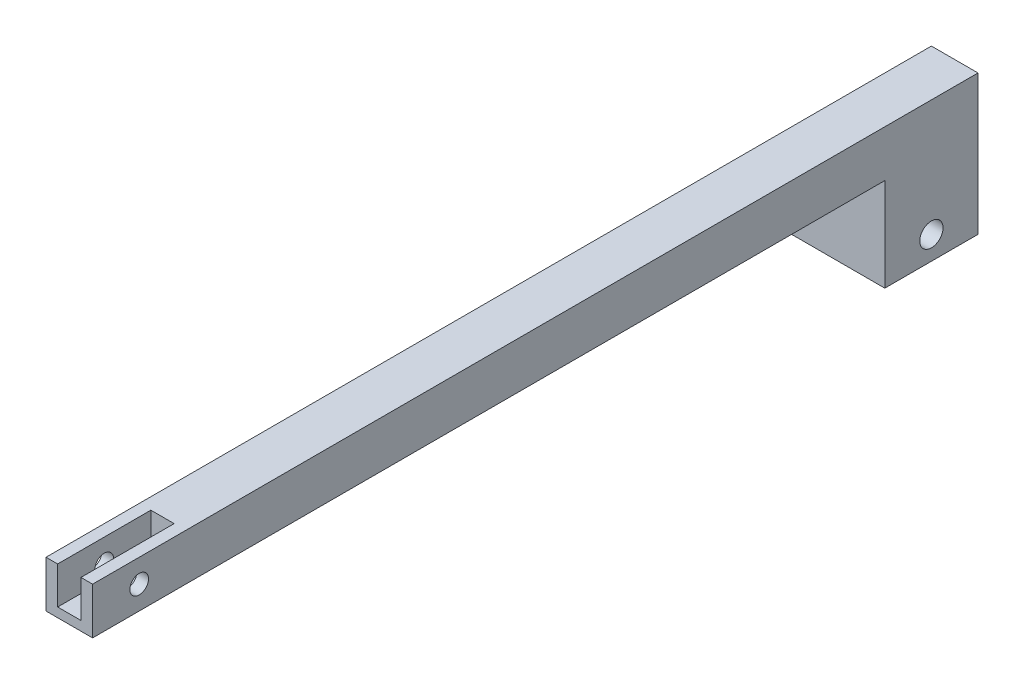
from build123d import *

# Parameters (mm, degrees)
BOSS_EXTRUDE1_DEPTH = 190
SKETCH3_W           = 10
SKETCH3_H           = 170
CUT_EXTRUDE2_DEPTH  = 20
SKETCH4_W           = 170
SKETCH4_H           = 10
CUT_EXTRUDE3_DEPTH  = 20
SKETCH5_R           = 2.75
CUT_EXTRUDE4_DEPTH  = 10
SKETCH6_W           = 5
SKETCH6_H           = 20
CUT_EXTRUDE5_DEPTH  = 5
BOSS_EXTRUDE2_REACH = 195.391
SKETCH9_R           = 2.75
SKETCH9_R_2         = 2.5
SKETCH10_R          = 2.5
CUT_EXTRUDE6_DEPTH  = 194.390796058
SKETCH11_W          = 5
SKETCH11_H          = 20
CUT_EXTRUDE7_DEPTH  = 3
SKETCH12_R          = 2
CUT_EXTRUDE8_DEPTH  = 193.613602843


with BuildPart() as part:
    # Sketch2 → Boss-Extrude1 (new body)
    with BuildSketch(Plane.XY):
        Polygon((0, 0), (0, 10), (10, 10), (10, 30), (20, 30), (20, 0), align=None)
    extrude(amount=BOSS_EXTRUDE1_DEPTH)

    # Sketch3 → Cut-Extrude2 (cut)
    with BuildSketch(Plane.XZ):
        with Locations((15, 105)):
            Rectangle(SKETCH3_W, SKETCH3_H)
    extrude(amount=-CUT_EXTRUDE2_DEPTH, mode=Mode.SUBTRACT)

    # Sketch4 → Cut-Extrude3 (cut)
    with BuildSketch(Plane(origin=(10, 0, 0), x_dir=(0, 0, -1), z_dir=(1, 0, 0))):
        with Locations((-105, 5)):
            Rectangle(SKETCH4_W, SKETCH4_H)
    extrude(amount=-CUT_EXTRUDE3_DEPTH, mode=Mode.SUBTRACT)

    # Sketch5 → Cut-Extrude4 (cut)
    with BuildSketch(Plane.ZY):
        with Locations((10, 5)):
            Circle(SKETCH5_R)
    extrude(amount=-CUT_EXTRUDE4_DEPTH, mode=Mode.SUBTRACT)

    # Sketch6 → Cut-Extrude5 (cut)
    with BuildSketch(Plane(origin=(0, 30, 0), x_dir=(1, 0, 0), z_dir=(0, 1, 0))):
        with Locations((15, -180)):
            Rectangle(SKETCH6_W, SKETCH6_H)
    extrude(amount=-CUT_EXTRUDE5_DEPTH, mode=Mode.SUBTRACT)

    # Sketch9 → Boss-Extrude2 (add, up to next)
    with BuildSketch(Plane.ZY, mode=Mode.PRIVATE) as boss_extrude2_sk1:
        with Locations((10, 5)):
            Circle(SKETCH9_R)
        with Locations((10, 5)):
            Circle(SKETCH9_R_2, mode=Mode.SUBTRACT)
    boss_extrude2_tool1 = extrude(boss_extrude2_sk1.sketch, amount=-BOSS_EXTRUDE2_REACH, mode=Mode.PRIVATE) - part.part
    add(boss_extrude2_tool1.solids().sort_by_distance((0, 5, 7.327782))[0])

    # Sketch10 → Cut-Extrude6 (cut, through all)
    with BuildSketch(Plane.ZY):
        with Locations((10, 5)):
            Circle(SKETCH10_R)
    extrude(amount=-CUT_EXTRUDE6_DEPTH, mode=Mode.SUBTRACT)

    # Sketch11 → Cut-Extrude7 (cut)
    with BuildSketch(Plane(origin=(0, 25, 0), x_dir=(1, 0, 0), z_dir=(0, 1, 0))):
        with Locations((15, -180)):
            Rectangle(SKETCH11_W, SKETCH11_H)
    extrude(amount=-CUT_EXTRUDE7_DEPTH, mode=Mode.SUBTRACT)

    # Sketch12 → Cut-Extrude8 (cut, through all)
    with BuildSketch(Plane.ZY.offset(-10)):
        with Locations((180, 25)):
            Circle(SKETCH12_R)
    extrude(amount=-CUT_EXTRUDE8_DEPTH, mode=Mode.SUBTRACT)


solid = part.part
